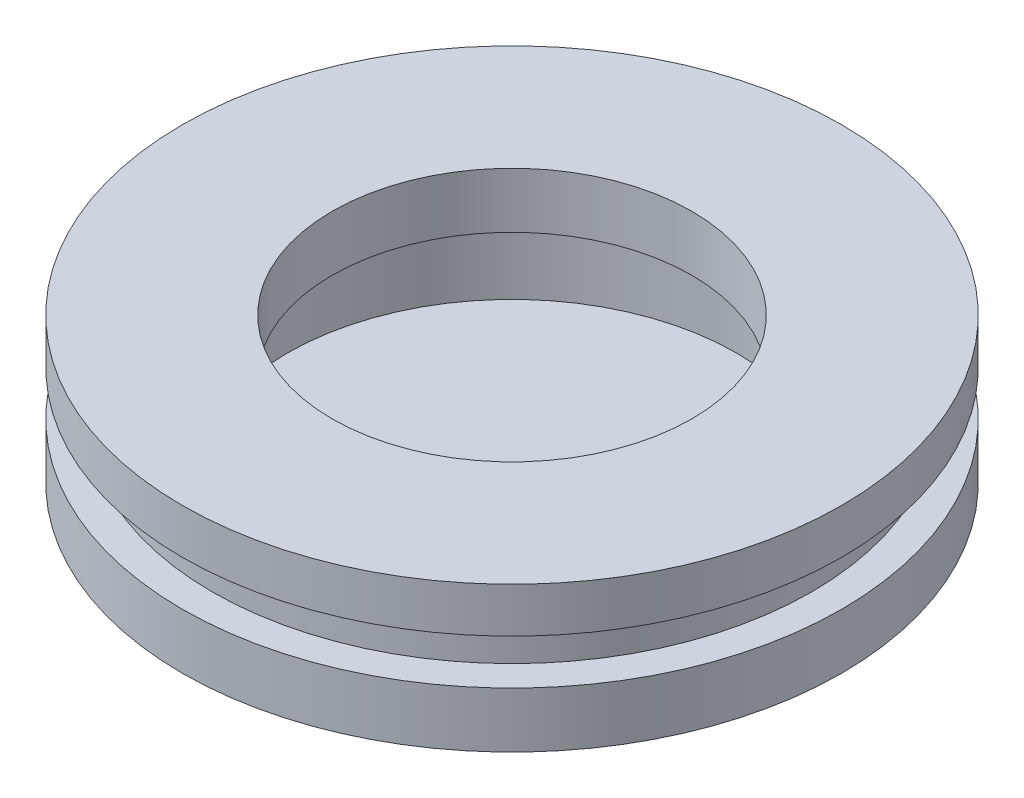
from build123d import *


with BuildPart() as part:
    # Sketch1 → Revolve1 (revolve)
    with BuildSketch(Plane.XY, mode=Mode.PRIVATE) as revolve1_sk:
        Polygon((0, 0), (0, 8.853672577), (-11, 8.853672577), (-11, 7.353672577), (-10, 7.353672577), (-10, 5.853672577), (-11, 5.853672577), (-11, 4.003672577), align=None)
    revolve(revolve1_sk.sketch.rotate(Axis((0, 0, 0), (0, 1, 0)), 270), axis=Axis((0, 0, 0), (0, 1, 0)))

    # Sketch2 → Cut-Revolve1 (revolve, cut)
    with BuildSketch(Plane.XY, mode=Mode.PRIVATE) as cut_revolve1_sk:
        Polygon((0, 4.003672577), (0, 10.003672577), (-6, 10.003672577), (-6, 7.003672577), (-7.5, 7.003672577), (-7.5, 4.003672577), align=None)
    revolve(cut_revolve1_sk.sketch.rotate(Axis((0, 4.003672577, 0), (0, 1, 0)), 270), axis=Axis((0, 4.003672577, 0), (0, 1, 0)), mode=Mode.SUBTRACT)


solid = part.part
